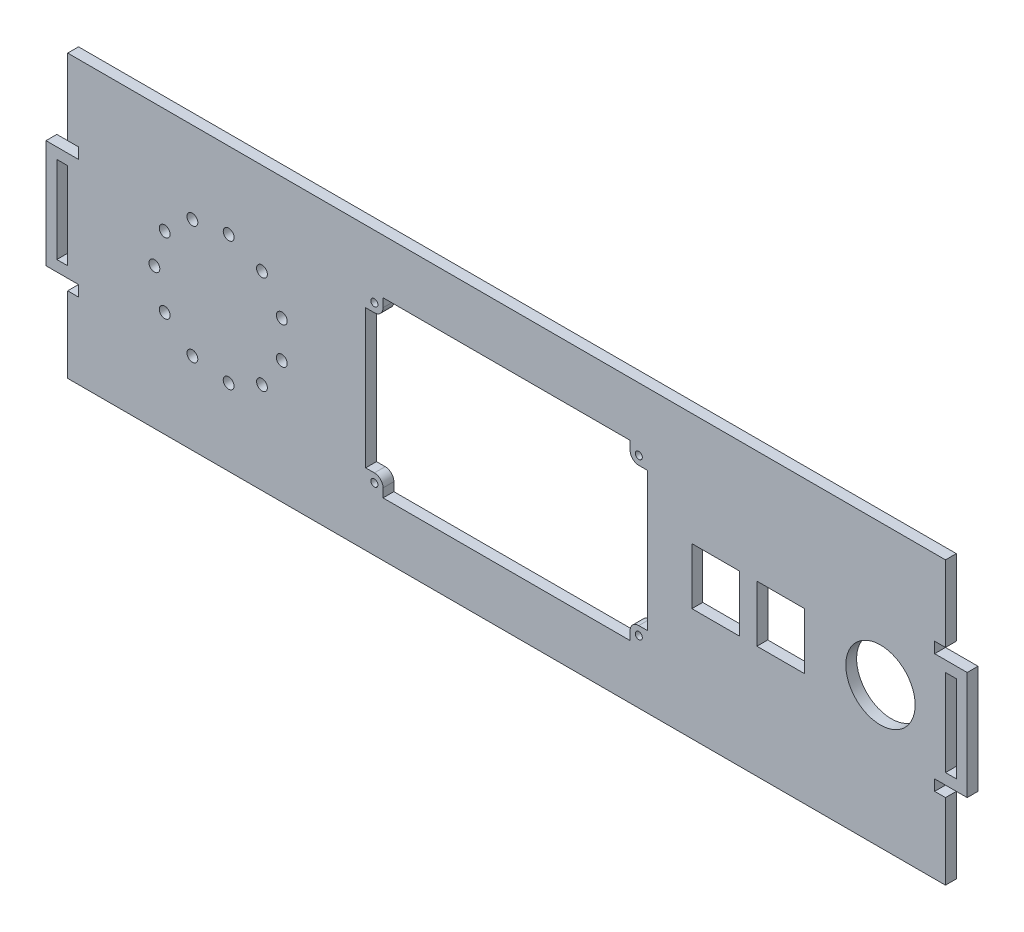
from build123d import *

# Parameters (mm, degrees)
SKETCH1_W           = 180
SKETCH1_H           = 130
BOSS_EXTRUDE1_DEPTH = 5
SKETCH2_W           = 130
SKETCH2_H           = 80
CUT_EXTRUDE1_DEPTH  = 10
SKETCH5_R           = 1.625
BOSS_EXTRUDE3_DEPTH = 5
SKETCH6_W           = 112.5
SKETCH6_H           = 130
BOSS_EXTRUDE4_DEPTH = 5
SKETCH7_W           = 5
SKETCH7_H           = 5
CUT_EXTRUDE2_DEPTH  = 5
BOSS_EXTRUDE5_DEPTH = 5
SKETCH9_R           = 2.5
CUT_EXTRUDE3_DEPTH  = 5
SKETCH10_R          = 16
SKETCH10_W          = 22
SKETCH10_H          = 26
CUT_EXTRUDE4_DEPTH  = 5


with BuildPart() as part:
    # Sketch1 → Boss-Extrude1 (new body)
    with BuildSketch(Plane.XY):
        with Locations((-90, 65)):
            Rectangle(SKETCH1_W, SKETCH1_H)
    extrude(amount=BOSS_EXTRUDE1_DEPTH)

    # Sketch2 → Cut-Extrude1 (cut)
    with BuildSketch(Plane.XY.offset(5)):
        with Locations((-90, 65)):
            Rectangle(SKETCH2_W, SKETCH2_H)
    extrude(amount=-CUT_EXTRUDE1_DEPTH, mode=Mode.SUBTRACT)

    # Sketch5 → Boss-Extrude3 (add)
    # profile 1 of 4: a face of its own
    with BuildSketch(Plane.XY.offset(5)):
        with BuildLine():
            Line((-33, 101), (-33, 105))
            Line((-33, 105), (-25, 105))
            Line((-25, 105), (-25, 97))
            Line((-25, 97), (-29, 97))
            ThreePointArc((-29, 97), (-31.828427125, 98.171572875), (-33, 101))
        make_face()
        with Locations((-29, 101)):
            Circle(SKETCH5_R, mode=Mode.SUBTRACT)
    # profile 2 of 4: a face of its own
    with BuildSketch(Plane.XY.offset(5)):
        with BuildLine():
            Line((-155, 97), (-151, 97))
            ThreePointArc((-151, 97), (-148.171572875, 98.171572875), (-147, 101))
            Line((-147, 101), (-147, 105))
            Line((-147, 105), (-155, 105))
            Line((-155, 105), (-155, 97))
        make_face()
        with Locations(Location((-151, 101, 0), (0, 0, 180))):
            Circle(SKETCH5_R, mode=Mode.SUBTRACT)
    # profile 3 of 4: a face of its own
    with BuildSketch(Plane.XY.offset(5)):
        with BuildLine():
            Line((-25, 33), (-29, 33))
            ThreePointArc((-29, 33), (-31.828427125, 31.828427125), (-33, 29))
            Line((-33, 29), (-33, 25))
            Line((-33, 25), (-25, 25))
            Line((-25, 25), (-25, 33))
        make_face()
        with Locations(Location((-29, 29, 0), (0, 0, 180))):
            Circle(SKETCH5_R, mode=Mode.SUBTRACT)
    # profile 4 of 4: a face of its own
    with BuildSketch(Plane.XY.offset(5)):
        with BuildLine():
            Line((-147, 29), (-147, 25))
            Line((-147, 25), (-155, 25))
            Line((-155, 25), (-155, 33))
            Line((-155, 33), (-151, 33))
            ThreePointArc((-151, 33), (-148.171572875, 31.828427125), (-147, 29))
        make_face()
        with Locations((-151, 29)):
            Circle(SKETCH5_R, mode=Mode.SUBTRACT)
    extrude(amount=-BOSS_EXTRUDE3_DEPTH)

    # Sketch6 → Boss-Extrude4 (add)
    with BuildSketch(Plane.XY.offset(5)):
        with Locations((-236.25, 65)):
            Rectangle(SKETCH6_W, SKETCH6_H)
        with Locations((56.25, 65)):
            Rectangle(SKETCH6_W, SKETCH6_H)
    extrude(amount=-BOSS_EXTRUDE4_DEPTH)

    # Sketch7 → Cut-Extrude2 (cut)
    with BuildSketch(Plane.XY.offset(5)):
        with Locations((-290, 37.5)):
            Rectangle(SKETCH7_W, SKETCH7_H)
        with Locations((-290, 92.5)):
            Rectangle(SKETCH7_W, SKETCH7_H)
        with Locations((110, 92.5)):
            Rectangle(SKETCH7_W, SKETCH7_H)
        with Locations((110, 37.5)):
            Rectangle(SKETCH7_W, SKETCH7_H)
    extrude(amount=-CUT_EXTRUDE2_DEPTH, mode=Mode.SUBTRACT)

    # Sketch8 → Boss-Extrude5 (add)
    with BuildSketch(Plane.XY.offset(5)):
        Polygon((-302.5, 40), (-292.5, 40), (-292.5, 45), (-297.5, 45), (-297.5, 85), (-292.5, 85), (-292.5, 90), (-302.5, 90), align=None)
        Polygon((117.5, 85), (117.5, 45), (112.5, 45), (112.5, 40), (122.5, 40), (122.5, 90), (112.5, 90), (112.5, 85), align=None)
    extrude(amount=-BOSS_EXTRUDE5_DEPTH)

    # Sketch9 → Cut-Extrude3 (cut)
    with BuildSketch(Plane.XY.offset(5)):
        with Locations((-252.5, 65)):
            Circle(SKETCH9_R)
        with Locations((-247.737605985, 81.219224524)):
            Circle(SKETCH9_R)
        with Locations((-234.96245039, 92.288959861)):
            Circle(SKETCH9_R)
        with Locations((-218.230554852, 94.694643256)):
            Circle(SKETCH9_R)
        with Locations((-202.854177982, 87.672487231)):
            Circle(SKETCH9_R)
        with Locations((-193.715210792, 73.451976705)):
            Circle(SKETCH9_R)
        with Locations((-193.715210792, 56.548023295)):
            Circle(SKETCH9_R)
        with Locations((-202.854177982, 42.327512769)):
            Circle(SKETCH9_R)
        with Locations((-218.230554852, 35.305356744)):
            Circle(SKETCH9_R)
        with Locations((-234.96245039, 37.711040139)):
            Circle(SKETCH9_R)
        with Locations((-247.737605985, 48.780775476)):
            Circle(SKETCH9_R)
    extrude(amount=-CUT_EXTRUDE3_DEPTH, mode=Mode.SUBTRACT)

    # Sketch10 → Cut-Extrude4 (cut)
    with BuildSketch(Plane.XY.offset(5)):
        with Locations((82.5, 65)):
            Circle(SKETCH10_R)
        with Locations((6.5, 65)):
            Rectangle(SKETCH10_W, SKETCH10_H)
        with Locations((36.5, 65)):
            Rectangle(SKETCH10_W, SKETCH10_H)
    extrude(amount=-CUT_EXTRUDE4_DEPTH, mode=Mode.SUBTRACT)


solid = part.part
